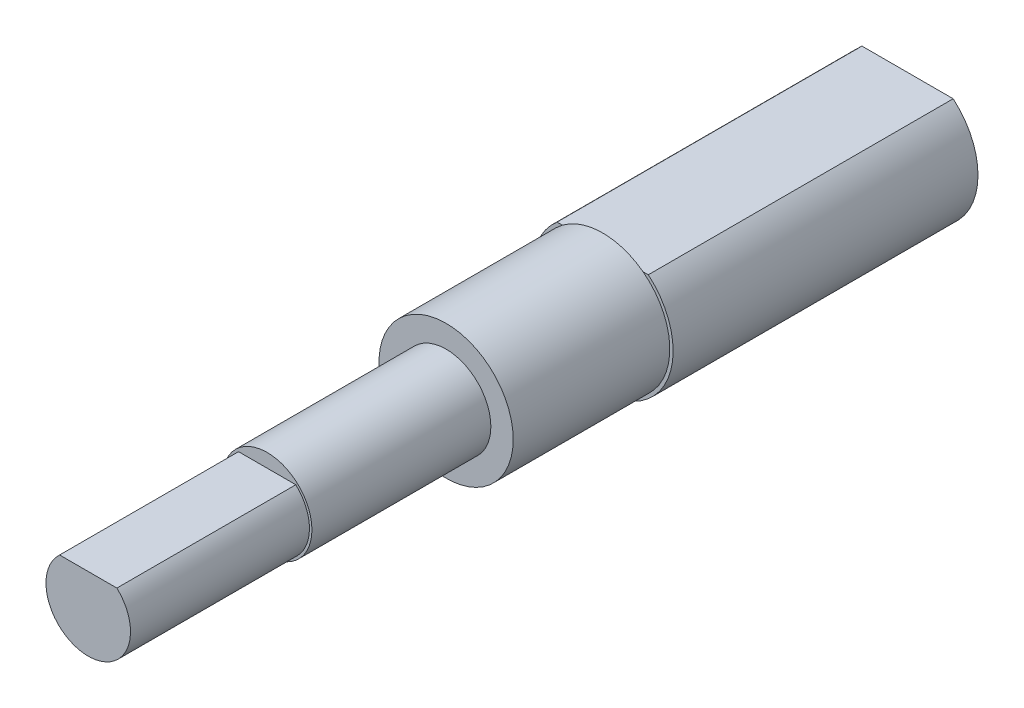
from build123d import *

# Parameters (mm, degrees)
SKETCH1_R           = 5
BOSS_EXTRUDE1_DEPTH = 21.637500032
SKETCH2_R           = 4.7625
BOSS_EXTRUDE2_DEPTH = 11.1125
SKETCH3_R           = 3.175
BOSS_EXTRUDE3_DEPTH = 12.7
SKETCH4_W           = 25.4
SKETCH4_H           = 2.38125
CUT_EXTRUDE1_DEPTH  = 21.637500032
SKETCH6_R           = 3
BOSS_EXTRUDE4_DEPTH = 12.7
SKETCH7_W           = 25.37250579
SKETCH7_H           = 1.5875
CUT_EXTRUDE3_DEPTH  = 12.7


with BuildPart() as part:
    # Sketch1 → Boss-Extrude1 (new body)
    with BuildSketch(Plane.XY):
        Circle(SKETCH1_R)
    extrude(amount=BOSS_EXTRUDE1_DEPTH)

    # Sketch2 → Boss-Extrude2 (add)
    with BuildSketch(Plane.XY.offset(21.637500032)):
        Circle(SKETCH2_R)
    extrude(amount=BOSS_EXTRUDE2_DEPTH)

    # Sketch3 → Boss-Extrude3 (add)
    with BuildSketch(Plane.XY.offset(32.750000032)):
        Circle(SKETCH3_R)
    extrude(amount=BOSS_EXTRUDE3_DEPTH)

    # Sketch4 → Cut-Extrude1 (cut)
    with BuildSketch(Plane(origin=(0, 0, 0), x_dir=(-1, 0, 0), z_dir=(0, 0, -1))):
        with Locations((0, 5)):
            Rectangle(SKETCH4_W, SKETCH4_H)
    extrude(amount=-CUT_EXTRUDE1_DEPTH, mode=Mode.SUBTRACT)

    # Sketch6 → Boss-Extrude4 (add)
    with BuildSketch(Plane.XY.offset(45.450000032)):
        Circle(SKETCH6_R)
    extrude(amount=BOSS_EXTRUDE4_DEPTH)

    # Sketch7 → Cut-Extrude3 (cut)
    with BuildSketch(Plane.XY.offset(58.150000032)):
        with Locations((0, 3)):
            Rectangle(SKETCH7_W, SKETCH7_H)
    extrude(amount=-CUT_EXTRUDE3_DEPTH, mode=Mode.SUBTRACT)


solid = part.part
